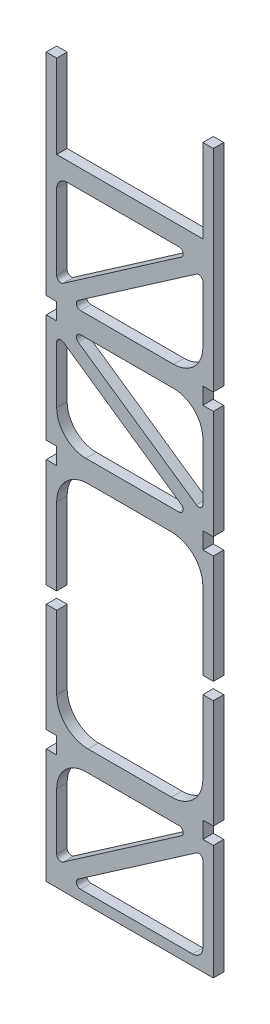
from build123d import *

# Parameters (mm, degrees)
BOSS_EXTRUDE1_DEPTH = 6.35
CUT_EXTRUDE1_DEPTH  = 6.35
SKETCH2_W           = 6.35
SKETCH2_H           = 10.16
CUT_EXTRUDE2_DEPTH  = 6.35


with BuildPart() as part:
    # Model → Boss-Extrude1 (new body)
    with BuildSketch(Plane.XY):
        Polygon((-95.25, 386.08), (-6.35, 386.08), (-6.35, 436.88), (0, 436.88), (0, 0), (-101.6, 0), (-101.6, 436.88), (-95.25, 436.88), align=None)
        with BuildLine():
            Line((-80.76878597, 311.15), (-24.13, 311.15))
            ThreePointArc((-24.13, 311.15), (-11.557641431, 316.357641431), (-6.35, 328.93))
            Line((-6.35, 328.93), (-6.35, 363.45223644))
            ThreePointArc((-6.35, 363.45223644), (-7.711169032, 365.702115893), (-10.335793346, 365.540604607))
            Line((-10.335793346, 365.540604607), (-82.214579316, 315.778368167))
            ThreePointArc((-82.214579316, 315.778368167), (-83.193250358, 312.932654354), (-80.76878597, 311.15))
        make_face(mode=Mode.SUBTRACT)
        with BuildLine():
            Line((-95.25, 287.25223644), (-95.25, 252.73))
            ThreePointArc((-95.25, 252.73), (-90.042358569, 240.157641431), (-77.47, 234.95))
            Line((-77.47, 234.95), (-20.83121403, 234.95))
            ThreePointArc((-20.83121403, 234.95), (-18.406749642, 236.732654354), (-19.385420684, 239.578368167))
            Line((-19.385420684, 239.578368167), (-91.264206654, 289.340604607))
            ThreePointArc((-91.264206654, 289.340604607), (-93.888830968, 289.502115893), (-95.25, 287.25223644))
        make_face(mode=Mode.SUBTRACT)
        with BuildLine():
            Line((-82.214579316, 293.821631833), (-10.335793346, 244.059395393))
            ThreePointArc((-10.335793346, 244.059395393), (-7.711169032, 243.897884107), (-6.35, 246.14776356))
            Line((-6.35, 246.14776356), (-6.35, 280.67))
            ThreePointArc((-6.35, 280.67), (-11.557641431, 293.242358569), (-24.13, 298.45))
            Line((-24.13, 298.45), (-80.76878597, 298.45))
            ThreePointArc((-80.76878597, 298.45), (-83.193250358, 296.667345646), (-82.214579316, 293.821631833))
        make_face(mode=Mode.SUBTRACT)
        with BuildLine():
            Line((-80.76878597, 6.35), (-12.7, 6.35))
            ThreePointArc((-12.7, 6.35), (-8.209871939, 8.209871939), (-6.35, 12.7))
            Line((-6.35, 12.7), (-6.35, 58.65223644))
            ThreePointArc((-6.35, 58.65223644), (-7.711169032, 60.902115893), (-10.335793346, 60.740604607))
            Line((-10.335793346, 60.740604607), (-82.214579316, 10.978368167))
            ThreePointArc((-82.214579316, 10.978368167), (-83.193250358, 8.132654354), (-80.76878597, 6.35))
        make_face(mode=Mode.SUBTRACT)
        with BuildLine():
            Line((-20.83121403, 69.85), (-77.47, 69.85))
            ThreePointArc((-77.47, 69.85), (-90.042358569, 64.642358569), (-95.25, 52.07))
            Line((-95.25, 52.07), (-95.25, 17.54776356))
            ThreePointArc((-95.25, 17.54776356), (-93.888830968, 15.297884107), (-91.264206654, 15.459395393))
            Line((-91.264206654, 15.459395393), (-19.385420684, 65.221631833))
            ThreePointArc((-19.385420684, 65.221631833), (-18.406749642, 68.067345646), (-20.83121403, 69.85))
        make_face(mode=Mode.SUBTRACT)
        with BuildLine():
            Line((-20.83121403, 374.65), (-88.9, 374.65))
            ThreePointArc((-88.9, 374.65), (-93.390128061, 372.790128061), (-95.25, 368.3))
            Line((-95.25, 368.3), (-95.25, 322.34776356))
            ThreePointArc((-95.25, 322.34776356), (-93.888830968, 320.097884107), (-91.264206654, 320.259395393))
            Line((-91.264206654, 320.259395393), (-19.385420684, 370.021631833))
            ThreePointArc((-19.385420684, 370.021631833), (-18.406749642, 372.867345646), (-20.83121403, 374.65))
        make_face(mode=Mode.SUBTRACT)
    extrude(amount=BOSS_EXTRUDE1_DEPTH)

    # Sketch1 → Cut-Extrude1 (cut)
    with BuildSketch(Plane.XY.offset(6.35)):
        with BuildLine():
            Line((-95.25, 203.2), (-95.25, 101.6))
            ThreePointArc((-95.25, 101.6), (-89.670384182, 88.129615818), (-76.2, 82.55))
            Line((-76.2, 82.55), (-25.4, 82.55))
            ThreePointArc((-25.4, 82.55), (-11.929615818, 88.129615818), (-6.35, 101.6))
            Line((-6.35, 101.6), (-6.35, 203.2))
            ThreePointArc((-6.35, 203.2), (-11.929615818, 216.670384182), (-25.4, 222.25))
            Line((-25.4, 222.25), (-76.2, 222.25))
            ThreePointArc((-76.2, 222.25), (-89.670384182, 216.670384182), (-95.25, 203.2))
        make_face()
    extrude(amount=-CUT_EXTRUDE1_DEPTH, mode=Mode.SUBTRACT)

    # Sketch2 → Cut-Extrude2 (cut)
    with BuildSketch(Plane.XY.offset(6.35)):
        with Locations((-98.425, 74.93)):
            Rectangle(SKETCH2_W, SKETCH2_H)
        with Locations((-98.425, 151.13)):
            Rectangle(SKETCH2_W, SKETCH2_H)
        with Locations((-98.425, 227.33)):
            Rectangle(SKETCH2_W, SKETCH2_H)
        with Locations((-98.425, 303.53)):
            Rectangle(SKETCH2_W, SKETCH2_H)
        with Locations((-3.175, 303.53)):
            Rectangle(SKETCH2_W, SKETCH2_H)
        with Locations((-3.175, 227.33)):
            Rectangle(SKETCH2_W, SKETCH2_H)
        with Locations((-3.175, 151.13)):
            Rectangle(SKETCH2_W, SKETCH2_H)
        with Locations((-3.175, 74.93)):
            Rectangle(SKETCH2_W, SKETCH2_H)
    extrude(amount=-CUT_EXTRUDE2_DEPTH, mode=Mode.SUBTRACT)


with BuildPart() as cut_extrude2_piece_1:
    # of the separate pieces the step leaves, piece 1, a body of its own (cut_extrude2_pieces)
    add(part.part.solids().sort_by_distance((-95.25, 386.08, 0))[0])


with BuildPart() as cut_extrude2_piece_2:
    # of the separate pieces the step leaves, piece 2, a body of its own (cut_extrude2_pieces)
    add(part.part.solids().sort_by_distance((-101.6, 80.01, 0))[0])


solid = Compound([cut_extrude2_piece_1.part, cut_extrude2_piece_2.part])
